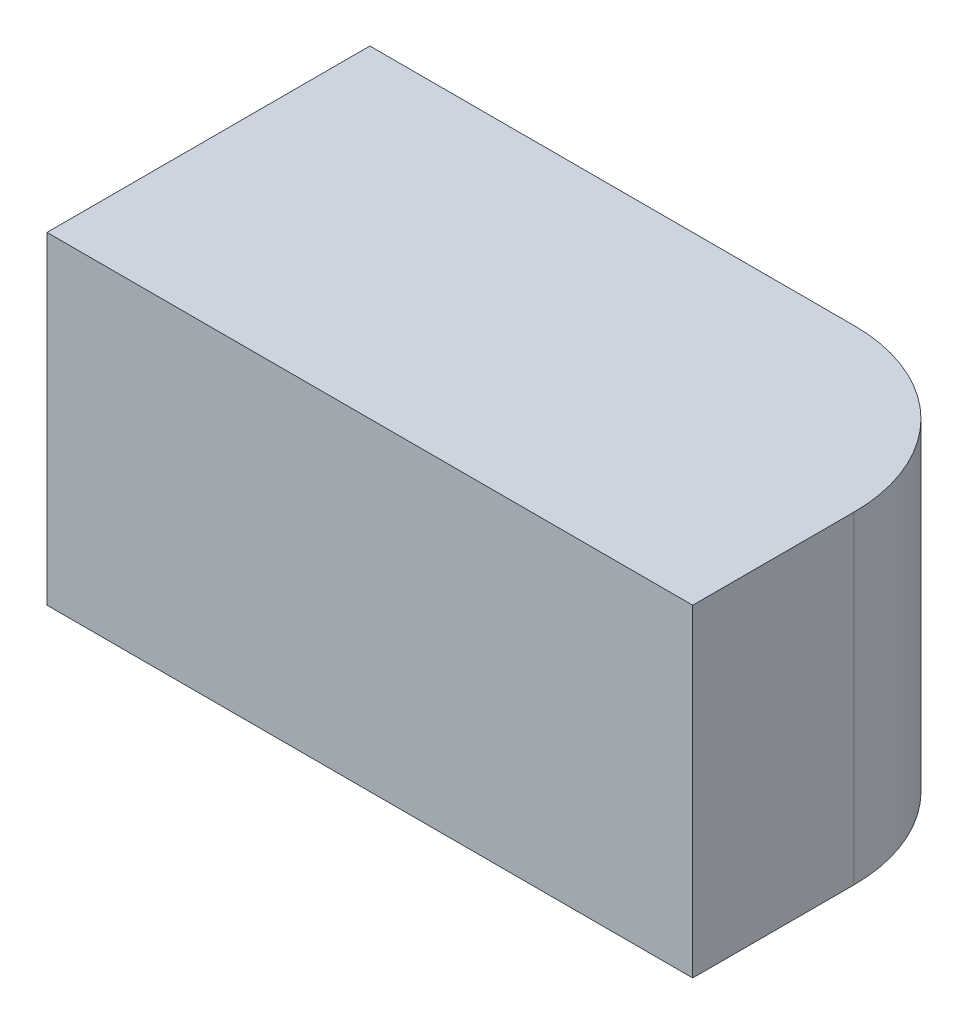
from build123d import *

# Parameters (mm, degrees)
BOSS_EXTRUDE1_DEPTH = 20


with BuildPart() as part:
    # Sketch1 → Boss-Extrude1 (new body)
    with BuildSketch(Plane(origin=(0, 0, 0), x_dir=(1, 0, 0), z_dir=(0, 1, 0))):
        with BuildLine():
            Line((0, 0), (30, 0))
            Line((30, 0), (30, -20))
            Line((30, -20), (-10, -20))
            Line((-10, -20), (-10, -10))
            ThreePointArc((-10, -10), (-7.071067812, -2.928932188), (0, 0))
        make_face()
    extrude(amount=BOSS_EXTRUDE1_DEPTH)


with BuildPart() as body_2:
    # Mirror2: mirrored copy
    add(part.part.mirror(Plane(origin=(-10, 20, 20), x_dir=(0, 0, 1), z_dir=(1, 0, 0))))


solid = body_2.part
